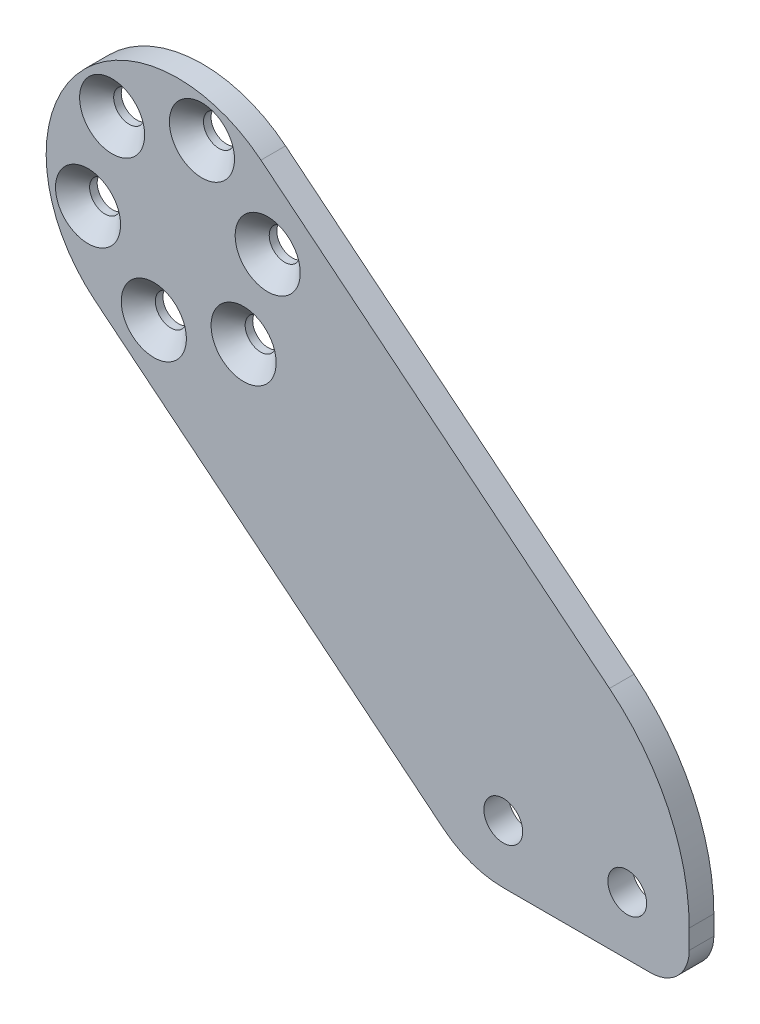
from build123d import *

# Parameters (mm, degrees)
SKETCH1_R           = 2
SKETCH1_R_2         = 2.5
BOSS_EXTRUDE1_DEPTH = 3.175
FILLET1_R           = 5
CHAMFER1_SIZE       = 2.2


with BuildPart() as part:
    # Sketch1 → Boss-Extrude1 (new body)
    with BuildSketch(Plane.XY):
        with BuildLine():
            Line((34.261326859, -49.751843123), (-10.721932331, -13.1924284))
            ThreePointArc((-10.721932331, -13.1924284), (-13.1924284, 10.721932331), (10.721932331, 13.1924284))
            Line((10.721932331, 13.1924284), (55.705191521, -23.366986323))
            ThreePointArc((55.705191521, -23.366986323), (63.295065064, -33.021160716), (66, -45))
            Line((66, -45), (66, -52.5))
            Line((66, -52.5), (42, -52.5))
            ThreePointArc((42, -52.5), (37.893924373, -51.792566974), (34.261326859, -49.751843123))
        make_face()
        with Locations((-8.485281374, 8.485281374)):
            Circle(SKETCH1_R, mode=Mode.SUBTRACT)
        with Locations((3.105828541, 11.591109915)):
            Circle(SKETCH1_R, mode=Mode.SUBTRACT)
        with Locations((11.591109915, 3.105828541)):
            Circle(SKETCH1_R, mode=Mode.SUBTRACT)
        with Locations((8.485281374, -8.485281374)):
            Circle(SKETCH1_R, mode=Mode.SUBTRACT)
        with Locations((42, -45)):
            Circle(SKETCH1_R_2, mode=Mode.SUBTRACT)
        with Locations((58, -45)):
            Circle(SKETCH1_R_2, mode=Mode.SUBTRACT)
        with Locations((-3.105828541, -11.591109915)):
            Circle(SKETCH1_R, mode=Mode.SUBTRACT)
        with Locations((-11.591109915, -3.105828541)):
            Circle(SKETCH1_R, mode=Mode.SUBTRACT)
    extrude(amount=BOSS_EXTRUDE1_DEPTH)

    # Fillet1
    fillet1_edges = [part.edges().sort_by_distance(p)[0] for p in [
        (66, -52.5, 1.5875),
    ]]
    fillet(fillet1_edges, radius=FILLET1_R)

    # Chamfer1
    chamfer1_edges = [part.edges().sort_by_distance(p)[0] for p in [
        (-10.485281374, 8.485281374, 3.175),
        (1.105828541, 11.591109915, 3.175),
        (9.591109915, 3.105828541, 3.175),
        (6.485281374, -8.485281374, 3.175),
        (-5.105828541, -11.591109915, 3.175),
        (-13.591109915, -3.105828541, 3.175),
    ]]
    chamfer(chamfer1_edges, length=CHAMFER1_SIZE)


solid = part.part
